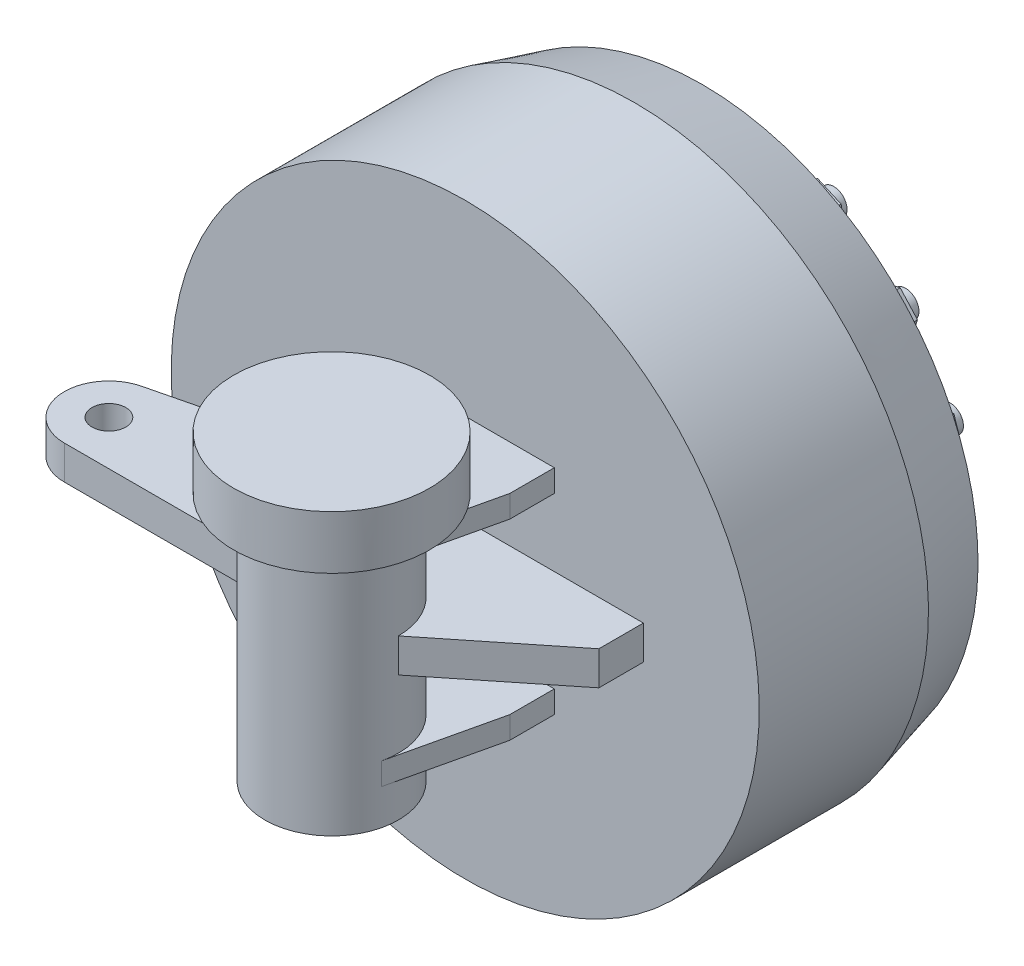
from build123d import *

# Parameters (mm, degrees)
CHAMFER1_SIZE            = 4
FILLET1_R                = 3.5
BOSS_EXTRUDE1_DEPTH      = 90
BOSS_EXTRUDE1_DEPTH_BACK = 80
SKETCH2_R                = 37.5
BOSS_EXTRUDE2_START      = 60
BOSS_EXTRUDE2_DEPTH      = 12.5
SKETCH4_R                = 9.5
BOSS_EXTRUDE3_DEPTH      = 9.5
SKETCH5_R                = 55
BOSS_EXTRUDE4_DEPTH      = 30
SKETCH6_R                = 7.5
BOSS_EXTRUDE5_DEPTH      = 25
BOSS_EXTRUDE6_START      = 5
SKETCH6_3_R              = 7.5
BOSS_EXTRUDE6_DEPTH      = 12.5
CIRPATTERN1_COUNT        = 15


with BuildPart() as part:
    # Sketch1 → Revolve1 (revolve)
    with BuildSketch(Plane(origin=(0, 0, 0), x_dir=(0, 0, -1), z_dir=(1, 0, 0))):
        Polygon((0, 0), (0, 165), (95, 165), (133, 154.817930688), (133, 75), (158, 75), (158, 50), (183, 50), (183, 0), align=None)
    revolve(axis=Axis((0, 0, -183), (0, 0, 1)))

    # Chamfer1
    chamfer1_edges = [part.edges().sort_by_distance(p)[0] for p in [
        (0, -50, -183),
    ]]
    chamfer(chamfer1_edges, length=CHAMFER1_SIZE)

    # Fillet1
    fillet1_edges = [part.edges().sort_by_distance(p)[0] for p in [
        (0, -50, -158),
        (0, -75, -158),
    ]]
    fillet(fillet1_edges, radius=FILLET1_R)



with BuildPart() as body_2:
    # Sketch2 → Boss-Extrude1 (new, two sides: drawn at the far end of the back side and taken through both)
    with BuildSketch(Plane(origin=(0, 0, 0), x_dir=(1, 0, 0), z_dir=(0, 1, 0)).offset(-BOSS_EXTRUDE1_DEPTH_BACK)):
        with Locations(Location((0, -75, 0), (0, 0, 270))):
            Circle(SKETCH2_R)
    extrude(amount=BOSS_EXTRUDE1_DEPTH + BOSS_EXTRUDE1_DEPTH_BACK)


with BuildPart() as part_1:
    add(part.part)

    add(body_2.part)  # Boss-Extrude2 merges body 2
    # Sketch3 → Boss-Extrude2 (add)
    with BuildSketch(Plane(origin=(0, 0, 0), x_dir=(1, 0, 0), z_dir=(0, 1, 0)).offset(BOSS_EXTRUDE2_START)):
        Polygon((-50, 0), (50, 0), (50, -25), (36.542960266, -83.417960266), (-36.542960266, -83.417960266), (-50, -25), align=None)
    boss_extrude2 = extrude(amount=-BOSS_EXTRUDE2_DEPTH)

    # Mirror1: Boss-Extrude2 across plane
    add(boss_extrude2.mirror(Plane.ZX))

    # Sketch4 → Boss-Extrude3 (add, symmetric)
    with BuildSketch(Plane(origin=(0, 0, 0), x_dir=(1, 0, 0), z_dir=(0, 1, 0))):
        with BuildLine():
            Line((-50, 0), (100, 0))
            Line((100, 0), (100, -25))
            Line((100, -25), (37.5, -75))
            ThreePointArc((37.5, -75), (0, -37.5), (-37.5, -75))
            Line((-37.5, -75), (-150, -75))
            ThreePointArc((-150, -75), (-174.822997079, -52.969649142), (-155.897247359, -25.705505282))
            Line((-155.897247359, -25.705505282), (-50, 0))
        make_face()
        with Locations(Location((-150, -50, 0), (0, 0, 270))):
            Circle(SKETCH4_R, mode=Mode.SUBTRACT)
    extrude(amount=BOSS_EXTRUDE3_DEPTH, both=True)

    # Sketch5 → Boss-Extrude4 (add)
    with BuildSketch(Plane(origin=(0, 60, 0), x_dir=(1, 0, 0), z_dir=(0, 1, 0))):
        with Locations(Location((0, -75, 0), (0, 0, 145.958125966))):
            Circle(SKETCH5_R)
    extrude(amount=BOSS_EXTRUDE4_DEPTH)

    # Sketch6 → Boss-Extrude5 (add)
    with BuildSketch(Plane(origin=(0, 0, -133), x_dir=(-1, 0, 0), z_dir=(0, 0, -1))):
        with Locations((0, 120)):
            Circle(SKETCH6_R)
    boss_extrude5 = extrude(amount=BOSS_EXTRUDE5_DEPTH)

    # Sketch6<3> → Boss-Extrude6 (add)
    with BuildSketch(Plane(origin=(0, 0, -133), x_dir=(-1, 0, 0), z_dir=(0, 0, -1)).offset(BOSS_EXTRUDE6_START)):
        Polygon((14.43375673, 120), (7.216878365, 132.5), (-7.216878365, 132.5), (-14.43375673, 120), (-7.216878365, 107.5), (7.216878365, 107.5), align=None)
        with Locations((0, 120)):
            Circle(SKETCH6_3_R, mode=Mode.SUBTRACT)
    boss_extrude6 = extrude(amount=BOSS_EXTRUDE6_DEPTH)

    # CirPattern1: Boss-Extrude5, Boss-Extrude6 ×15 about axis
    cirpattern1_axis = Axis((0, 0, 0), (0, 0, 1))
    add([boss_extrude5.rotate(cirpattern1_axis, i * 360 / CIRPATTERN1_COUNT) for i in range(1, CIRPATTERN1_COUNT)])
    add([boss_extrude6.rotate(cirpattern1_axis, i * 360 / CIRPATTERN1_COUNT) for i in range(1, CIRPATTERN1_COUNT)])


solid = part_1.part
